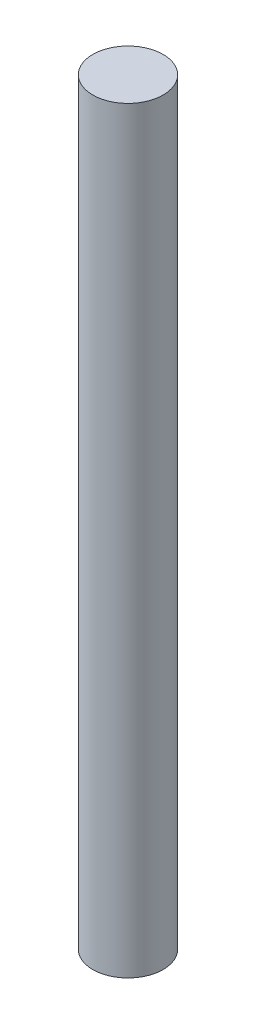
from build123d import *

# Parameters (mm, degrees)
SCHIZZO1_R                   = 65
ESTRUSIONE_ESTRUSIONE1_DEPTH = 700


with BuildPart() as part:
    # Schizzo1 → Estrusione-Estrusione1 (new body)
    with BuildSketch(Plane(origin=(0, 0, 0), x_dir=(-1, 0, 0), z_dir=(0, 1, 0))):
        with Locations(Location((-48.579824052, 412.034943085, 0), (0, 0, 90))):
            Circle(SCHIZZO1_R)
    extrude(amount=ESTRUSIONE_ESTRUSIONE1_DEPTH)

    # Specchia1: part across plane


with BuildPart() as part_1:
    add(part.part)
    add(part.part.mirror(Plane.ZX))


solid = part_1.part
